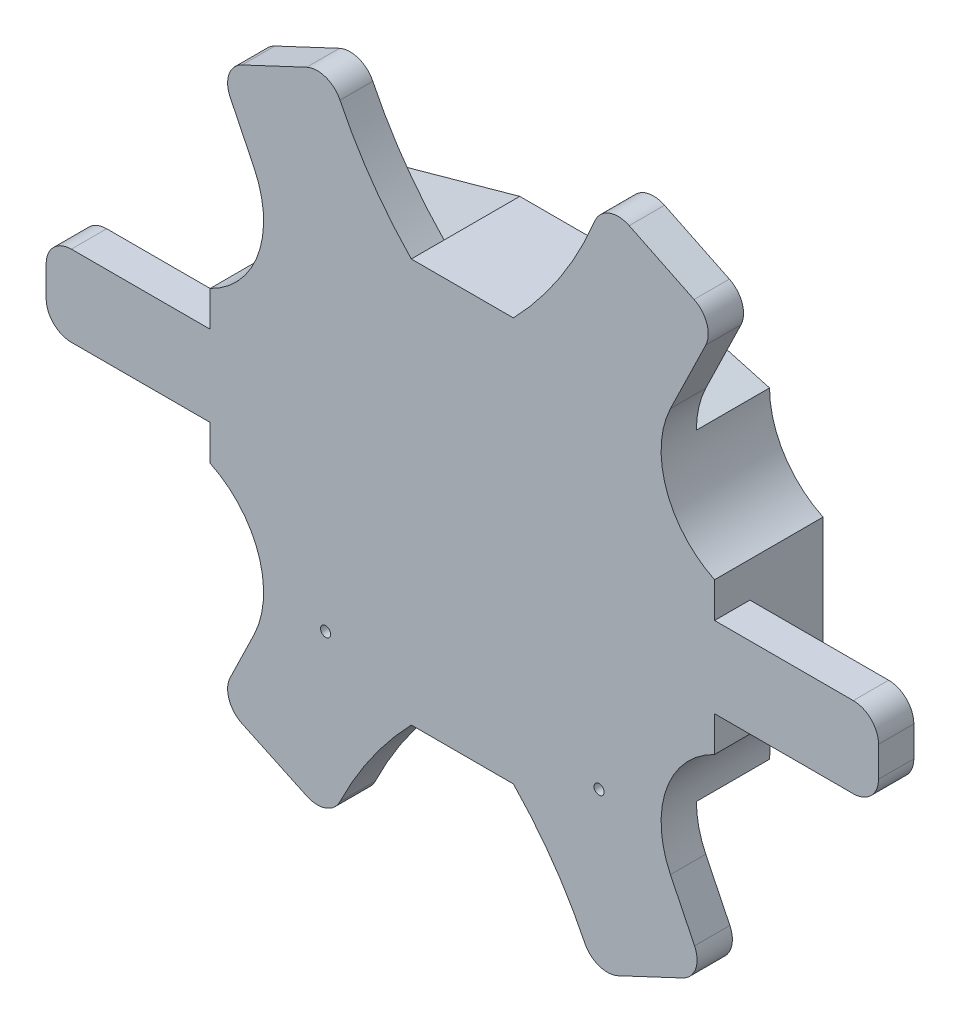
from build123d import *

# Parameters (mm, degrees)
SKETCH_1_W           = 65
SKETCH_1_H           = 25
SKETCH_1_W_2         = 17.5
SKETCH_1_H_2         = 30
EXTRUDE_1_DEPTH      = 21.5
SKETCH_2_W           = 37.5
SKETCH_2_H           = 30
EXTRUDE_2_DEPTH      = 7
CUT_EXTRUDE_21_DEPTH = 15
CUT_EXTRUDE_23_DEPTH = 14.5
CUT_EXTRUDE_24_DEPTH = 14.5
CUT_EXTRUDE_25_DEPTH = 14.5
CUT_EXTRUDE_27_DEPTH = 14.5
CUT_EXTRUDE_28_DEPTH = 0.5
CUT_EXTRUDE_START    = -10
CUT_EXTRUDE_32_DEPTH = 10
SKETCH_14_W          = 37.5
SKETCH_14_H          = 7
CUT_EXTRUDE_33_DEPTH = 10
SKETCH_15_R          = 1
CUT_EXTRUDE_34_DEPTH = 30
EXTRUDE_3_DEPTH      = 20
SKETCH_18_R          = 1
CUT_EXTRUDE_35_DEPTH = 20
SKETCH_19_R          = 1
CUT_EXTRUDE_36_DEPTH = 20
SKETCH_20_W          = 55
SKETCH_20_H          = 35
CUT_EXTRUDE_37_DEPTH = 20
SKETCH_21_W          = 35.200875269
SKETCH_21_H          = 10.973883626
CUT_EXTRUDE_38_DEPTH = 26
SKETCH_25_W          = 4.333842745
SKETCH_25_H          = 3.588286738
CUT_EXTRUDE_41_DEPTH = 26
CUT_EXTRUDE_42_DEPTH = 23
SKETCH_29_W          = 5
SKETCH_29_H          = 16
CUT_EXTRUDE_43_DEPTH = 23
SKETCH_30_R          = 1.55
CUT_EXTRUDE_44_DEPTH = 10
SKETCH_31_R          = 1.55
CUT_EXTRUDE_45_DEPTH = 6.100799321
SKETCH_32_R          = 1.55
EXTRUDE_4_DEPTH      = 15
SKETCH_33_R          = 1.55
CUT_EXTRUDE_46_DEPTH = 12
CUT_EXTRUDE_49_DEPTH = 10
CUT_EXTRUDE_50_DEPTH = 25
CUT_EXTRUDE_START_2  = -25
CUT_EXTRUDE_51_DEPTH = 25
CUT_EXTRUDE_52_DEPTH = 25
CUT_EXTRUDE_55_DEPTH = 25
CUT_EXTRUDE_56_DEPTH = 25
CUT_EXTRUDE_59_DEPTH = 25
CUT_EXTRUDE_60_DEPTH = 25
CUT_EXTRUDE_61_DEPTH = 25
CUT_EXTRUDE_62_DEPTH = 25
CUT_EXTRUDE_63_DEPTH = 25


with BuildPart() as part:
    # 草图1 → 凸台-拉伸1 (new body)
    with BuildSketch(Plane.XY):
        with Locations((0, 27.5)):
            Rectangle(SKETCH_1_W, SKETCH_1_H)
        with BuildLine():
            ThreePointArc((-41.25, 40), (-40.44733047, 25.687815665), (-50, 15))
            Line((-50, 15), (-32.5, 15))
            Line((-32.5, 15), (-32.5, 40))
            Line((-32.5, 40), (-41.25, 40))
        make_face()
        with BuildLine():
            Line((32.5, 40), (32.5, 15))
            Line((32.5, 15), (50, 15))
            ThreePointArc((50, 15), (40.44733047, 25.687815665), (41.25, 40))
            Line((41.25, 40), (32.5, 40))
        make_face()
        with Locations((41.25, 0)):
            Rectangle(SKETCH_1_W_2, SKETCH_1_H_2)
        Rectangle(SKETCH_1_W, SKETCH_1_H_2)
        with Locations((-41.25, 0)):
            Rectangle(SKETCH_1_W_2, SKETCH_1_H_2)
        with BuildLine():
            ThreePointArc((-50, -15), (-40.44733047, -25.687815665), (-41.25, -40))
            Line((-41.25, -40), (-32.5, -40))
            Line((-32.5, -40), (-32.5, -15))
            Line((-32.5, -15), (-50, -15))
        make_face()
        with Locations((0, -27.5)):
            Rectangle(SKETCH_1_W, SKETCH_1_H)
        with BuildLine():
            Line((32.5, -15), (32.5, -40))
            Line((32.5, -40), (41.25, -40))
            ThreePointArc((41.25, -40), (40.44733047, -25.687815665), (50, -15))
            Line((50, -15), (32.5, -15))
        make_face()
    extrude(amount=EXTRUDE_1_DEPTH)

    # 草图2 → 凸台-拉伸2 (add)
    with BuildSketch(Plane.XY.offset(21.5)):
        with Locations((68.75, 0)):
            Rectangle(SKETCH_2_W, SKETCH_2_H)
        with BuildLine():
            ThreePointArc((31.362634986, 83.717731106), (24.230066028, 60.16346689), (10.119378388, 40))
            Line((10.119378388, 40), (41.25, 40))
            Line((41.25, 40), (56.546841385, 71.480257998))
            Line((56.546841385, 71.480257998), (31.362634986, 83.717731106))
        make_face()
        with BuildLine():
            Line((-56.546841385, 71.480257998), (-41.25, 40))
            Line((-41.25, 40), (-10.119378388, 40))
            ThreePointArc((-10.119378388, 40), (-24.230066028, 60.16346689), (-31.362634986, 83.717731106))
            Line((-31.362634986, 83.717731106), (-56.546841385, 71.480257998))
        make_face()
        with Locations((-68.75, 0)):
            Rectangle(SKETCH_2_W, SKETCH_2_H)
        with BuildLine():
            ThreePointArc((-31.362634986, -83.717731106), (-24.230066028, -60.16346689), (-10.119378388, -40))
            Line((-10.119378388, -40), (-41.25, -40))
            Line((-41.25, -40), (-56.546841385, -71.480257998))
            Line((-56.546841385, -71.480257998), (-31.362634986, -83.717731106))
        make_face()
        with BuildLine():
            Line((41.25, -40), (10.119378388, -40))
            ThreePointArc((10.119378388, -40), (24.230066028, -60.16346689), (31.362634986, -83.717731106))
            Line((31.362634986, -83.717731106), (56.546841385, -71.480257998))
            Line((56.546841385, -71.480257998), (41.25, -40))
        make_face()
    extrude(amount=-EXTRUDE_2_DEPTH)

    # 草图6 → 切除-拉伸21 (cut)
    with BuildSketch(Plane(origin=(0, 0, 0), x_dir=(-1, 0, 0), z_dir=(0, 0, -1))):
        Polygon((10.119378388, 40), (39.39584492, 31.875), (56.837191822, 38.348903147), (0, 62.639769561), align=None)
    extrude(amount=-CUT_EXTRUDE_21_DEPTH, mode=Mode.SUBTRACT)

    # 草图7 → 切除-拉伸23 (cut)
    with BuildSketch(Plane(origin=(0, 0, 0), x_dir=(-1, 0, 0), z_dir=(0, 0, -1))):
        Polygon((-10.119378388, -40), (-39.39584492, -31.875), (-53.358394545, -39.771171687), (-19.086589639, -55.987329608), align=None)
    extrude(amount=-CUT_EXTRUDE_23_DEPTH, mode=Mode.SUBTRACT)

    # 草图9 → 切除-拉伸24 (cut)
    with BuildSketch(Plane(origin=(0, 0, 0), x_dir=(-1, 0, 0), z_dir=(0, 0, -1))):
        Polygon((-10.119378388, 40), (-39.39584492, 31.875), (-58.125, 43.883609099), (-7.923028206, 48.831046035), align=None)
    extrude(amount=-CUT_EXTRUDE_24_DEPTH, mode=Mode.SUBTRACT)

    # 草图10 → 切除-拉伸25 (cut)
    with BuildSketch(Plane(origin=(0, 0, 0), x_dir=(-1, 0, 0), z_dir=(0, 0, -1))):
        Polygon((10.119378388, 40), (42.266947865, 21.909889239), (59.804647536, 30.954944619), (0, 68.202746977), align=None)
    extrude(amount=-CUT_EXTRUDE_25_DEPTH, mode=Mode.SUBTRACT)

    # 草图11 → 切除-拉伸27 (cut)
    with BuildSketch(Plane(origin=(0, 0, 0), x_dir=(-1, 0, 0), z_dir=(0, 0, -1))):
        Polygon((10.119378388, -40), (39.39584492, -31.875), (61.586062569, -40), (5.344245099, -59.295671812), align=None)
    extrude(amount=-CUT_EXTRUDE_27_DEPTH, mode=Mode.SUBTRACT)

    # 草图12 → 切除-拉伸28 (cut)
    with BuildSketch(Plane(origin=(0, 0, 14.5), x_dir=(-1, 0, 0), z_dir=(0, 0, -1))):
        Polygon((10.119378388, 40), (42.266947865, 21.909889239), (51.083391038, 30.954944619), (39.39584492, 31.875), align=None)
    extrude(amount=-CUT_EXTRUDE_28_DEPTH, mode=Mode.SUBTRACT)

    # 草图13 → 切除-拉伸32 (cut)
    with BuildSketch(Plane(origin=(0, 0, 14.5), x_dir=(-1, 0, 0), z_dir=(0, 0, -1)).offset(CUT_EXTRUDE_START)):
        Polygon((10.58865897, 82.694112306), (52.176315275, 62.48589857), (56.546841385, 71.480257998), (17.786028214, 90.314856211), align=None)
        Polygon((-14.643214372, 80.723928615), (-19.490898913, 89.48642791), (-56.546841385, 71.480257998), (-52.176315275, 62.48589857), align=None)
        Polygon((-52.176315275, -62.48589857), (-56.546841385, -71.480257998), (-18.055185597, -90.184067645), (-12.656512081, -81.689304116), align=None)
        with BuildLine():
            Line((31.362634986, -83.717731106), (56.546841385, -71.480257998))
            Line((56.546841385, -71.480257998), (52.176315275, -62.48589857))
            Line((52.176315275, -62.48589857), (29.292654399, -73.605493929))
            ThreePointArc((29.292654399, -73.605493929), (30.494954113, -78.627364186), (31.362634986, -83.717731106))
        make_face()
    extrude(amount=CUT_EXTRUDE_32_DEPTH, mode=Mode.SUBTRACT)

    # 草图14 → 切除-拉伸33 (cut)
    with BuildSketch(Plane(origin=(0, 0, 14.5), x_dir=(-1, 0, 0), z_dir=(0, 0, -1))):
        with Locations((68.75, -11.5)):
            Rectangle(SKETCH_14_W, SKETCH_14_H)
        with Locations((-68.75, -11.5)):
            Rectangle(SKETCH_14_W, SKETCH_14_H)
        with Locations((68.75, 11.5)):
            Rectangle(SKETCH_14_W, SKETCH_14_H)
        with Locations((-68.75, 11.5)):
            Rectangle(SKETCH_14_W, SKETCH_14_H)
    extrude(amount=-CUT_EXTRUDE_33_DEPTH, mode=Mode.SUBTRACT)

    # 草图15 → 切除-拉伸34 (cut)
    with BuildSketch(Plane(origin=(0, 0, 0), x_dir=(-1, 0, 0), z_dir=(0, 0, -1))):
        with Locations((-27.097478675, -32.434184843)):
            Circle(SKETCH_15_R)
        with Locations((27.097478675, -32.434184843)):
            Circle(SKETCH_15_R)
    extrude(amount=-CUT_EXTRUDE_34_DEPTH, mode=Mode.SUBTRACT)

    # 草图17 → 凸台-拉伸3 (add)
    with BuildSketch(Plane(origin=(0, 0, 0), x_dir=(-1, 0, 0), z_dir=(0, 0, -1))):
        with BuildLine():
            ThreePointArc((42.266947865, 21.909889239), (40.127928465, 26.6897646), (39.39584492, 31.875))
            Line((39.39584492, 31.875), (10.119378388, 40))
            Line((10.119378388, 40), (42.266947865, 21.909889239))
        make_face()
    extrude(amount=-EXTRUDE_3_DEPTH)

    # 草图18 → 切除-拉伸35 (cut)
    with BuildSketch(Plane(origin=(0, 0, 0), x_dir=(-1, 0, 0), z_dir=(0, 0, -1))):
        with Locations((-27.097478675, 32.434184843)):
            Circle(SKETCH_18_R)
        with Locations((27.097478675, 32.434184843)):
            Circle(SKETCH_18_R)
    extrude(amount=-CUT_EXTRUDE_35_DEPTH, mode=Mode.SUBTRACT)

    # 草图19 → 切除-拉伸36 (cut)
    with BuildSketch(Plane(origin=(0, 0, 0), x_dir=(-1, 0, 0), z_dir=(0, 0, -1))):
        with Locations((-47.25, 0)):
            Circle(SKETCH_19_R)
        with Locations((47.25, 0)):
            Circle(SKETCH_19_R)
    extrude(amount=-CUT_EXTRUDE_36_DEPTH, mode=Mode.SUBTRACT)

    # 草图20 → 切除-拉伸37 (cut)
    with BuildSketch(Plane(origin=(0, 0, 0), x_dir=(-1, 0, 0), z_dir=(0, 0, -1))):
        Rectangle(SKETCH_20_W, SKETCH_20_H)
    extrude(amount=-CUT_EXTRUDE_37_DEPTH, mode=Mode.SUBTRACT)

    # 草图21 → 切除-拉伸38 (cut)
    with BuildSketch(Plane(origin=(-22.636232033, 52.965581396, 0), x_dir=(0.9195424781856313, 0.39299062433120197, 0), z_dir=(0.3929906243312019, -0.9195424781856312, 0))):
        with Locations((-4.83440857, 9.513058187)):
            Rectangle(SKETCH_21_W, SKETCH_21_H)
    extrude(amount=-CUT_EXTRUDE_38_DEPTH, mode=Mode.SUBTRACT)

    # 草图25 → 切除-拉伸41 (cut)
    with BuildSketch(Plane(origin=(-34.529716487, 71.060708302, 0), x_dir=(0.8994359428084866, 0.4370526110026218, 0), z_dir=(-0.4370526110026218, 0.8994359428084866, 0))):
        with Locations((-20.7982707, -13.205856631)):
            Rectangle(SKETCH_25_W, SKETCH_25_H)
    extrude(amount=-CUT_EXTRUDE_41_DEPTH, mode=Mode.SUBTRACT)

    # 草图28 → 切除-拉伸42 (cut)
    with BuildSketch(Plane(origin=(0, 0, 14.5), x_dir=(-1, 0, 0), z_dir=(0, 0, -1))):
        Polygon((52.176315275, -66.088986914), (50.428104831, -62.491243143), (15.200632854, -79.608925319), (16.948843298, -83.20666909), align=None)
        Polygon((56.312132831, -59.632084777), (58.060343275, -63.229828548), (52.176315275, -66.088986914), (50.428104831, -62.491243143), align=None)
        Polygon((-52.176315275, -66.088986914), (-50.428104831, -62.491243143), (-15.200632854, -79.608925319), (-16.948843298, -83.20666909), align=None)
        Polygon((-50.428104831, -62.491243143), (-58.790509719, -58.427795468), (-60.538720163, -62.025539239), (-52.176315275, -66.088986914), align=None)
        Polygon((-16.948843298, 79.603580746), (-15.200632854, 76.005836975), (-50.428104831, 58.888154799), (-52.176315275, 62.48589857), align=None)
        Polygon((52.176315275, 62.48589857), (50.428104831, 58.888154799), (15.200632854, 76.005836975), (16.948843298, 79.603580746), align=None)
    extrude(amount=-CUT_EXTRUDE_42_DEPTH, mode=Mode.SUBTRACT)

    # 草图29 → 切除-拉伸43 (cut)
    with BuildSketch(Plane(origin=(0, 0, 14.5), x_dir=(-1, 0, 0), z_dir=(0, 0, -1))):
        with Locations((-85, 0)):
            Rectangle(SKETCH_29_W, SKETCH_29_H)
        with Locations((85, 0)):
            Rectangle(SKETCH_29_W, SKETCH_29_H)
    extrude(amount=-CUT_EXTRUDE_43_DEPTH, mode=Mode.SUBTRACT)

    # 草图30 → 切除-拉伸44 (cut)
    with BuildSketch(Plane(origin=(0, 0, 0), x_dir=(-1, 0, 0), z_dir=(0, 0, -1))):
        with Locations((-37.5, 0)):
            Circle(SKETCH_30_R)
        with Locations((37.5, 0)):
            Circle(SKETCH_30_R)
    extrude(amount=-CUT_EXTRUDE_44_DEPTH, mode=Mode.SUBTRACT)

    # 草图31 → 切除-拉伸45 (cut)
    with BuildSketch(Plane(origin=(0, 0, 0), x_dir=(-1, 0, 0), z_dir=(0, 0, -1))):
        with Locations((-35.5, 0)):
            Circle(SKETCH_31_R)
    extrude(amount=-CUT_EXTRUDE_45_DEPTH, mode=Mode.SUBTRACT)

    # 草图32 → 凸台-拉伸4 (add)
    with BuildSketch(Plane(origin=(0, 0, 0), x_dir=(-1, 0, 0), z_dir=(0, 0, -1))):
        with Locations((-37.5, 0)):
            Circle(SKETCH_32_R)
    extrude(amount=-EXTRUDE_4_DEPTH)

    # 草图33 → 切除-拉伸46 (cut)
    with BuildSketch(Plane(origin=(0, 0, 0), x_dir=(-1, 0, 0), z_dir=(0, 0, -1))):
        with Locations((-35.5, 0)):
            Circle(SKETCH_33_R)
    extrude(amount=-CUT_EXTRUDE_46_DEPTH, mode=Mode.SUBTRACT)

    # 草图34 → 切除-拉伸49 (cut)
    with BuildSketch(Plane(origin=(0, 0, 14.5), x_dir=(-1, 0, 0), z_dir=(0, 0, -1))):
        with BuildLine():
            ThreePointArc((-77.5, -8), (-81.035533906, -6.535533906), (-82.5, -3))
            Line((-82.5, -3), (-82.5, -8))
            Line((-82.5, -8), (-77.5, -8))
        make_face()
        with BuildLine():
            Line((-82.5, 8), (-82.5, 3))
            ThreePointArc((-82.5, 3), (-81.035533906, 6.535533906), (-77.5, 8))
            Line((-77.5, 8), (-82.5, 8))
        make_face()
    extrude(amount=-CUT_EXTRUDE_49_DEPTH, mode=Mode.SUBTRACT)

    # 草图35 → 切除-拉伸50 (cut)
    with BuildSketch(Plane(origin=(0, 0, 14.5), x_dir=(-1, 0, 0), z_dir=(0, 0, -1))):
        with BuildLine():
            ThreePointArc((77.5, 8), (81.035533906, 6.535533906), (82.5, 3))
            Line((82.5, 3), (82.5, 8))
            Line((82.5, 8), (77.5, 8))
        make_face()
        with BuildLine():
            Line((82.5, -8), (82.5, -3))
            ThreePointArc((82.5, -3), (81.035533906, -6.535533906), (77.5, -8))
            Line((77.5, -8), (82.5, -8))
        make_face()
    extrude(amount=-CUT_EXTRUDE_50_DEPTH, mode=Mode.SUBTRACT)

    # 草图36 → 切除-拉伸51 (cut)
    with BuildSketch(Plane(origin=(0, 0, 14.5), x_dir=(-1, 0, 0), z_dir=(0, 0, -1)).offset(CUT_EXTRUDE_START_2)):
        with BuildLine():
            Line((-39.504333919, 72.905748912), (-33.07774272, 67.319017634))
            Line((-33.07774272, 67.319017634), (-28.118790882, 69.728664331))
            ThreePointArc((-28.118790882, 69.728664331), (-27.234796071, 67.206239647), (-26.264970905, 64.715554549))
            Line((-26.264970905, 64.715554549), (-25.306223542, 81.095943274))
            Line((-25.306223542, 81.095943274), (-42.89977916, 80.277638362))
            Line((-42.89977916, 80.277638362), (-39.504333919, 72.905748912))
        make_face()
        with BuildLine():
            ThreePointArc((33.07774272, 67.319017634), (29.107641849, 67.49242182), (26.264970905, 64.715554549))
            Line((26.264970905, 64.715554549), (17.767775768, 67.655318894))
            Line((17.767775768, 67.655318894), (26.848615448, 84.035744568))
            Line((26.848615448, 84.035744568), (28.820085623, 82.942817867))
            Line((28.820085623, 82.942817867), (36.635790353, 76.148509543))
            Line((36.635790353, 76.148509543), (33.07774272, 67.319017634))
        make_face()
        with BuildLine():
            ThreePointArc((48.242841776, 54.390975085), (48.470862659, 58.211010087), (45.930925117, 61.073417854))
            Line((45.930925117, 61.073417854), (49.061020363, 72.905748912))
            Line((49.061020363, 72.905748912), (54.994649752, 67.747556664))
            Line((54.994649752, 67.747556664), (55.514245962, 56.57623814))
            Line((55.514245962, 56.57623814), (53.680238507, 49.643355378))
            Line((53.680238507, 49.643355378), (48.242841776, 54.390975085))
        make_face()
        Polygon((-50.428104831, 58.888154799), (-45.930925117, 61.073417854), (-63.983419753, 67.319017634), (-64.704769924, 65.234002496), (-70.71583432, 54.390975085), (-54.957172435, 54.390975085), (-48.242841776, 54.390975085), align=None)
        with BuildLine():
            ThreePointArc((-33.07774272, -67.319017634), (-29.107641849, -67.49242182), (-26.264970905, -64.715554549))
            Line((-26.264970905, -64.715554549), (-14.718652678, -84.390540589))
            Line((-14.718652678, -84.390540589), (-54.027273861, -84.390540589))
            Line((-54.027273861, -84.390540589), (-58.903907316, -66.214912835))
            Line((-58.903907316, -66.214912835), (-58.903907316, -48.480785147))
            Line((-58.903907316, -48.480785147), (-48.242841776, -54.390975085))
            ThreePointArc((-48.242841776, -54.390975085), (-48.470862659, -58.211010087), (-45.930925117, -61.073417854))
            Line((-45.930925117, -61.073417854), (-33.07774272, -67.319017634))
        make_face()
        with BuildLine():
            Line((58.121394099, -59.411456741), (48.242841776, -54.390975085))
            ThreePointArc((48.242841776, -54.390975085), (48.470862659, -58.211010087), (45.930925117, -61.073417854))
            Line((45.930925117, -61.073417854), (33.07774272, -67.319017634))
            ThreePointArc((33.07774272, -67.319017634), (29.107641849, -67.49242182), (26.264970905, -64.715554549))
            Line((26.264970905, -64.715554549), (16.254972156, -74.725553298))
            Line((16.254972156, -74.725553298), (33.07774272, -82.900049612))
            Line((33.07774272, -82.900049612), (53.413827114, -73.018368929))
            Line((53.413827114, -73.018368929), (58.121394099, -59.411456741))
        make_face()
    extrude(amount=CUT_EXTRUDE_51_DEPTH, mode=Mode.SUBTRACT)

    # 草图37 → 切除-拉伸52 (cut)
    with BuildSketch(Plane(origin=(0, 0, 14.5), x_dir=(-1, 0, 0), z_dir=(0, 0, -1)).offset(CUT_EXTRUDE_START_2)):
        Polygon((-50.428104831, -58.888154799), (-49.456267727, -56.888154799), (-21.56050538, -70.443223247), (-22.532342484, -72.443223247), align=None)
        Polygon((50.428104831, -58.888154799), (49.456267727, -56.888154799), (21.56050538, -70.443223247), (22.532342484, -72.443223247), align=None)
        Polygon((50.428104831, 58.888154799), (49.456267727, 56.888154799), (21.56050538, 70.443223247), (22.532342484, 72.443223247), align=None)
        with BuildLine():
            Line((-22.532342484, 72.443223247), (-28.118790882, 69.728664331))
            ThreePointArc((-28.118790882, 69.728664331), (-27.759024767, 68.668415535), (-27.384090311, 67.61343529))
            Line((-27.384090311, 67.61343529), (-21.56050538, 70.443223247))
            Line((-21.56050538, 70.443223247), (-22.532342484, 72.443223247))
        make_face()
    extrude(amount=CUT_EXTRUDE_52_DEPTH, mode=Mode.SUBTRACT)

    # 草图38 → 切除-拉伸55 (cut)
    with BuildSketch(Plane(origin=(0, 0, 14.5), x_dir=(-1, 0, 0), z_dir=(0, 0, -1)).offset(CUT_EXTRUDE_START_2)):
        with BuildLine():
            Line((-28.118790882, 69.728664331), (-33.07774272, 67.319017634))
            ThreePointArc((-33.07774272, 67.319017634), (-29.107641849, 67.49242182), (-26.264970905, 64.715554549))
            ThreePointArc((-26.264970905, 64.715554549), (-27.234796071, 67.206239647), (-28.118790882, 69.728664331))
        make_face()
        with BuildLine():
            ThreePointArc((-48.242841776, 54.390975085), (-48.470862659, 58.211010087), (-45.930925117, 61.073417854))
            Line((-45.930925117, 61.073417854), (-50.428104831, 58.888154799))
            Line((-50.428104831, 58.888154799), (-48.242841776, 54.390975085))
        make_face()
    extrude(amount=CUT_EXTRUDE_55_DEPTH, mode=Mode.SUBTRACT)

    # 草图39 → 切除-拉伸56 (cut)
    with BuildSketch(Plane(origin=(0, 0, 15), x_dir=(-1, 0, 0), z_dir=(0, 0, -1))):
        Polygon((48.242841776, 54.390975085), (26.264970905, 64.715554549), (26.264970905, 71.368116994), (43.745662062, 64.715554549), (54.453178614, 55.789663045), align=None)
    extrude(amount=-CUT_EXTRUDE_56_DEPTH, mode=Mode.SUBTRACT)

    # 草图40 → 切除-拉伸59 (cut)
    with BuildSketch(Plane(origin=(0, 0, 15), x_dir=(-1, 0, 0), z_dir=(0, 0, -1)).offset(CUT_EXTRUDE_START_2)):
        with BuildLine():
            ThreePointArc((43.654966399, 56.544172545), (46.244717147, 53.684534957), (46.027848977, 49.832612805))
            Line((46.027848977, 49.832612805), (48.242841776, 54.390975085))
            Line((48.242841776, 54.390975085), (26.264970905, 64.715554549))
            ThreePointArc((26.264970905, 64.715554549), (25.292309142, 62.442144189), (24.248135755, 60.200678708))
            ThreePointArc((24.248135755, 60.200678708), (27.078564785, 62.731405098), (30.870769912, 62.544095633))
            Line((30.870769912, 62.544095633), (43.654966399, 56.544172545))
        make_face()
    extrude(amount=CUT_EXTRUDE_59_DEPTH, mode=Mode.SUBTRACT)

    # 草图41 → 切除-拉伸60 (cut)
    with BuildSketch(Plane(origin=(0, 0, 14.5), x_dir=(-1, 0, 0), z_dir=(0, 0, -1))):
        Polygon((-48.242841776, -54.390975085), (-26.264970905, -64.715554549), (-33.307203091, -81.924037924), (-55.077325326, -68.939499551), (-59.769437842, -58.193271975), align=None)
    extrude(amount=-CUT_EXTRUDE_60_DEPTH, mode=Mode.SUBTRACT)

    # 草图42 → 切除-拉伸61 (cut)
    with BuildSketch(Plane(origin=(0, 0, 14.5), x_dir=(-1, 0, 0), z_dir=(0, 0, -1)).offset(CUT_EXTRUDE_START_2)):
        with BuildLine():
            Line((-48.242841776, -54.390975085), (-43.657441558, -56.545065861))
            ThreePointArc((-43.657441558, -56.545065861), (-46.245836324, -53.685343094), (-46.028662238, -49.834286462))
            Line((-46.028662238, -49.834286462), (-48.242841776, -54.390975085))
        make_face()
        with BuildLine():
            ThreePointArc((-24.25102678, -60.206636989), (-27.082306467, -62.737980421), (-30.875507996, -62.549655184))
            Line((-30.875507996, -62.549655184), (-26.264970905, -64.715554549))
            ThreePointArc((-26.264970905, -64.715554549), (-25.293659643, -62.445167587), (-24.25102678, -60.206636989))
        make_face()
    extrude(amount=CUT_EXTRUDE_61_DEPTH, mode=Mode.SUBTRACT)

    # 草图43 → 切除-拉伸62 (cut)
    with BuildSketch(Plane(origin=(0, 0, 14.5), x_dir=(-1, 0, 0), z_dir=(0, 0, -1))):
        Polygon((48.242841776, -54.390975085), (26.264970905, -64.715554549), (26.264970905, -68.825223873), (37.25390634, -68.825223873), (50.755702933, -62.482463347), (52.393430427, -53.453956599), align=None)
    extrude(amount=-CUT_EXTRUDE_62_DEPTH, mode=Mode.SUBTRACT)

    # 草图44 → 切除-拉伸63 (cut)
    with BuildSketch(Plane(origin=(0, 0, 14.5), x_dir=(-1, 0, 0), z_dir=(0, 0, -1)).offset(CUT_EXTRUDE_START_2)):
        with BuildLine():
            Line((26.264970905, -64.715554549), (30.875507996, -62.549655184))
            ThreePointArc((30.875507996, -62.549655184), (27.082306467, -62.737980421), (24.25102678, -60.206636989))
            ThreePointArc((24.25102678, -60.206636989), (25.293659643, -62.445167587), (26.264970905, -64.715554549))
        make_face()
        with BuildLine():
            ThreePointArc((46.028662238, -49.834286462), (46.245836324, -53.685343094), (43.657441558, -56.545065861))
            Line((43.657441558, -56.545065861), (48.242841776, -54.390975085))
            Line((48.242841776, -54.390975085), (46.028662238, -49.834286462))
        make_face()
    extrude(amount=CUT_EXTRUDE_63_DEPTH, mode=Mode.SUBTRACT)


solid = part.part
